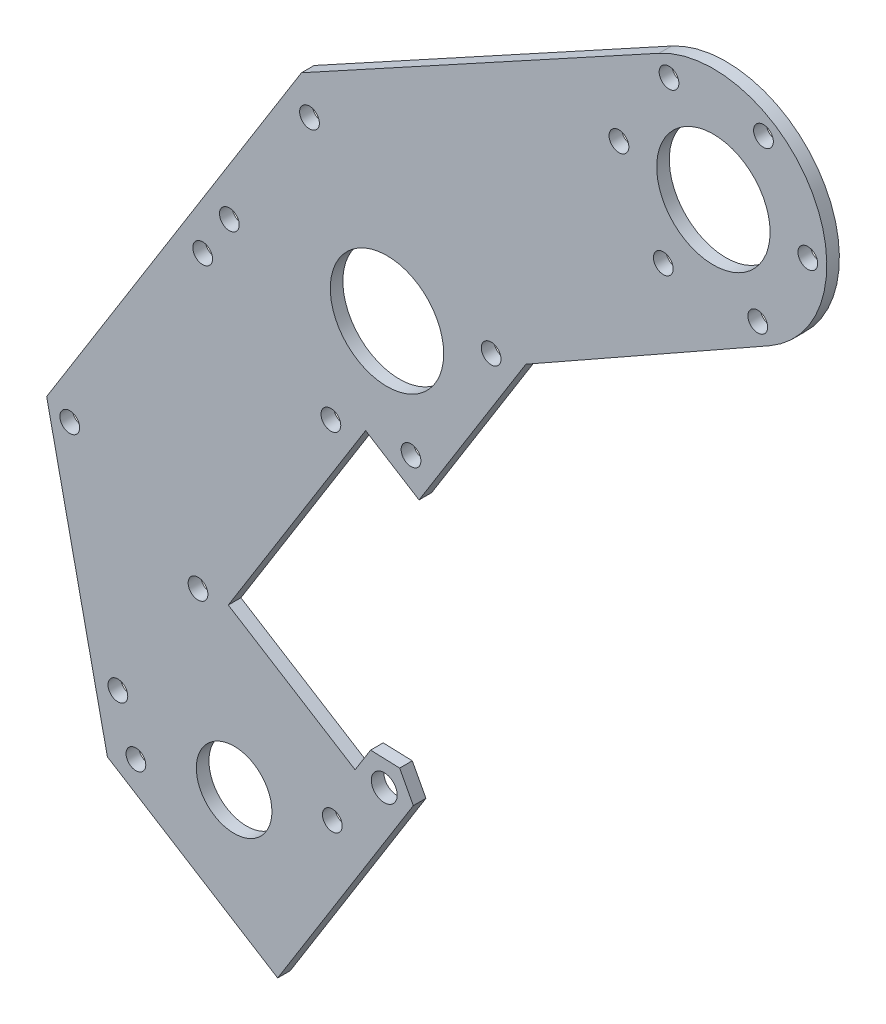
from build123d import *

# Parameters (mm, degrees)
SKETCH1_R               = 14.2875
SKETCH1_R_2             = 9.525
BOSS_EXTRUDE1_DEPTH     = 3.175
F_10_CLEARANCE_HOLE2_D  = 4.9784
F_10_CLEARANCE_HOLE3_D  = 4.9784
F_1_4_CLEARANCE_HOLE1_D = 6.5278


with BuildPart() as part:
    # Sketch1 → Boss-Extrude1 (new body)
    with BuildSketch(Plane.XY.offset(-14.194599474)):
        with BuildLine():
            Line((-11.403602879, 461.040918113), (18.881283072, 509.506866808))
            Line((18.881283072, 509.506866808), (22.784668372, 515.753589084))
            Line((22.784668372, 515.753589084), (19.342339301, 522.227668471))
            Line((19.342339301, 522.227668471), (12.014457551, 522.48356374))
            Line((12.014457551, 522.48356374), (8.11107225, 516.236841464))
            Line((8.11107225, 516.236841464), (-23.846467356, 536.206128526))
            Line((-23.846467356, 536.206128526), (10.759214603, 591.586796266))
            Line((10.759214603, 591.586796266), (24.22197813, 583.174327946))
            Line((24.22197813, 583.174327946), (51.141876753, 626.255171231))
            Line((51.141876753, 626.255171231), (112.462044501, 660.93728694))
            ThreePointArc((112.462044501, 660.93728694), (123.365099157, 699.702028841), (84.677956887, 710.877306848))
            Line((84.677956887, 710.877306848), (-5.401730059, 661.587538174))
            Line((-5.401730059, 661.587538174), (-69.615486106, 558.824047132))
            Line((-69.615486106, 558.824047132), (-54.307899735, 487.850498283))
            Line((-54.307899735, 487.850498283), (-11.403602879, 461.040918113))
        make_face()
        with Locations((16.14150623, 618.174698631)):
            Circle(SKETCH1_R, mode=Mode.SUBTRACT)
        with Locations((-22.373657227, 496.622766323)):
            Circle(SKETCH1_R_2, mode=Mode.SUBTRACT)
        with Locations((98.394472266, 685.809641802)):
            Circle(SKETCH1_R, mode=Mode.SUBTRACT)
    extrude(amount=BOSS_EXTRUDE1_DEPTH)

    # #10 Clearance Hole2 (through all)
    with Locations(Plane.XY.offset(-11.019599474)):
        with Locations((2.375342418, 502.336523103), (-47.122656873, 490.909009542), (-3.381611976, 652.837445435), (42.391784014, 624.235053148), (22.201860047, 591.924420685), (-23.571535943, 620.526812972), (-31.474844299, 535.981130963), (-63.785476762, 556.17105493), (-51.664768266, 503.670498499), (2.009121865, 589.566678183), (-30.301510599, 609.756602151)):
            Hole(F_10_CLEARANCE_HOLE2_D / 2)

    # #10 Clearance Hole3 (through all)
    with Locations(Plane.XY.offset(-11.019599474)):
        with Locations((111.013174745, 706.003787092), (122.192466334, 684.978597537), (109.573763855, 664.784452247), (85.775769786, 665.615496512), (74.596478197, 686.640686067), (87.215180677, 706.834831357)):
            Hole(F_10_CLEARANCE_HOLE3_D / 2)

    # 1/4 Clearance Hole1 (through all)
    with Locations(Plane.XY.offset(-11.019599474)):
        with Locations((15.456786622, 516.009484354)):
            Hole(F_1_4_CLEARANCE_HOLE1_D / 2)


solid = part.part
